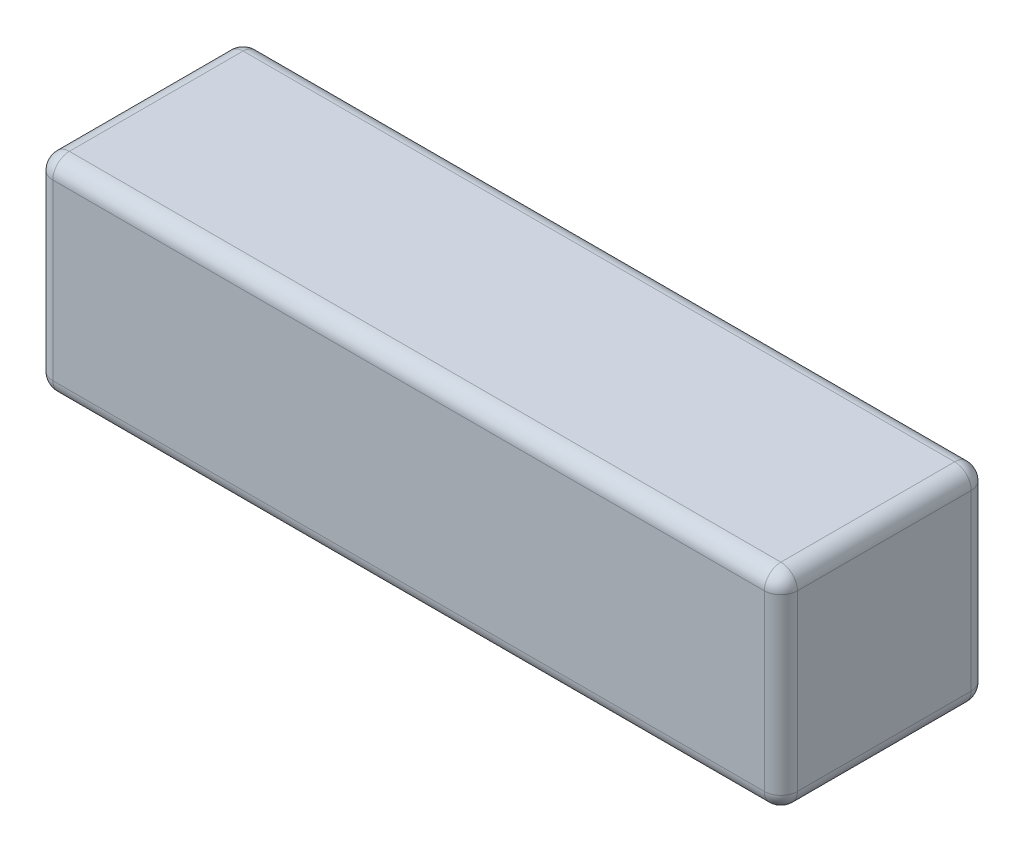
from build123d import *

# Parameters (mm, degrees)
SKETCH1_W           = 25
SKETCH1_H           = 25
BOSS_EXTRUDE1_DEPTH = 90
FILLET1_R           = 2


with BuildPart() as part:
    # Sketch1 → Boss-Extrude1 (new body)
    with BuildSketch(Plane(origin=(0, 0, 0), x_dir=(0, 0, -1), z_dir=(1, 0, 0))):
        Rectangle(SKETCH1_W, SKETCH1_H)
    extrude(amount=BOSS_EXTRUDE1_DEPTH)

    # Fillet1
    fillet1_edges = [part.edges().sort_by_distance(p)[0] for p in [
        (90, 0, 12.5),
        (90, -12.5, 0),
        (90, 0, -12.5),
        (0, -12.5, 0),
        (0, 0, 12.5),
        (0, 12.5, 0),
        (0, 0, -12.5),
        (45, -12.5, -12.5),
        (45, -12.5, 12.5),
        (45, 12.5, 12.5),
        (45, 12.5, -12.5),
        (90, 12.5, 0),
    ]]
    fillet(fillet1_edges, radius=FILLET1_R)


solid = part.part
